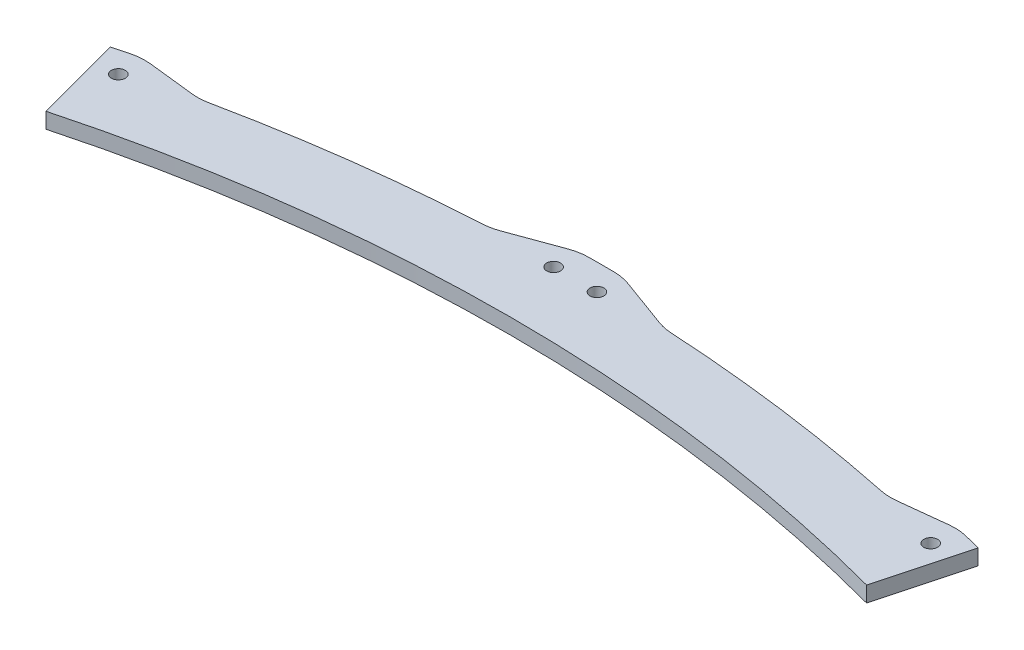
from build123d import *

# Parameters (mm, degrees)
SKETCH1_R           = 4
BOSS_EXTRUDE1_DEPTH = 9
FILLET1_R           = 30


with BuildPart() as part:
    # Sketch1 → Boss-Extrude1 (new body)
    with BuildSketch(Plane(origin=(0, 0, 0), x_dir=(1, 0, 0), z_dir=(0, 1, 0))):
        with BuildLine():
            ThreePointArc((-236.819426269, 883.822131054), (0, 915), (236.819426269, 883.822131054))
            Line((236.819426269, 883.822131054), (250.407426137, 934.533236935))
            ThreePointArc((250.407426137, 934.533236935), (243.155240373, 936.446356755), (235.888441696, 938.303198904))
            Line((235.888441696, 938.303198904), (198.536895902, 934.134947941))
            ThreePointArc((198.536895902, 934.134947941), (124.65251357, 946.829842612), (50, 953.690201271))
            Line((50, 953.690201271), (12.5, 967.419247276))
            ThreePointArc((12.5, 967.419247276), (0, 967.5), (-12.5, 967.419247276))
            Line((-12.5, 967.419247276), (-50, 953.690201271))
            ThreePointArc((-50, 953.690201271), (-124.65251357, 946.829842612), (-198.536895902, 934.134947941))
            Line((-198.536895902, 934.134947941), (-235.888441696, 938.303198904))
            ThreePointArc((-235.888441696, 938.303198904), (-243.155240373, 936.446356755), (-250.407426137, 934.533236935))
            Line((-250.407426137, 934.533236935), (-236.819426269, 883.822131054))
        make_face()
        with Locations(Location((12.5, 952.5, 0), (0, 0, 270))):
            Circle(SKETCH1_R, mode=Mode.SUBTRACT)
        with Locations(Location((-12.5, 952.5, 0), (0, 0, 270))):
            Circle(SKETCH1_R, mode=Mode.SUBTRACT)
        with Locations(Location((234.429838121, 923.200357993, 0), (0, 0, 270))):
            Circle(SKETCH1_R, mode=Mode.SUBTRACT)
        with Locations(Location((-234.429838121, 923.200357993, 0), (0, 0, 270))):
            Circle(SKETCH1_R, mode=Mode.SUBTRACT)
    extrude(amount=BOSS_EXTRUDE1_DEPTH)

    # Fillet1
    fillet1_edges = [part.edges().sort_by_distance(p)[0] for p in [
        (-235.888441696, 4.5, -938.303198904),
        (-198.536895902, 4.5, -934.134947941),
        (-50, 4.5, -953.690201271),
        (-12.5, 4.5, -967.419247276),
        (12.5, 4.5, -967.419247276),
        (50, 4.5, -953.690201271),
        (198.536895902, 4.5, -934.134947941),
        (235.888441696, 4.5, -938.303198904),
    ]]
    fillet(fillet1_edges, radius=FILLET1_R)


solid = part.part
